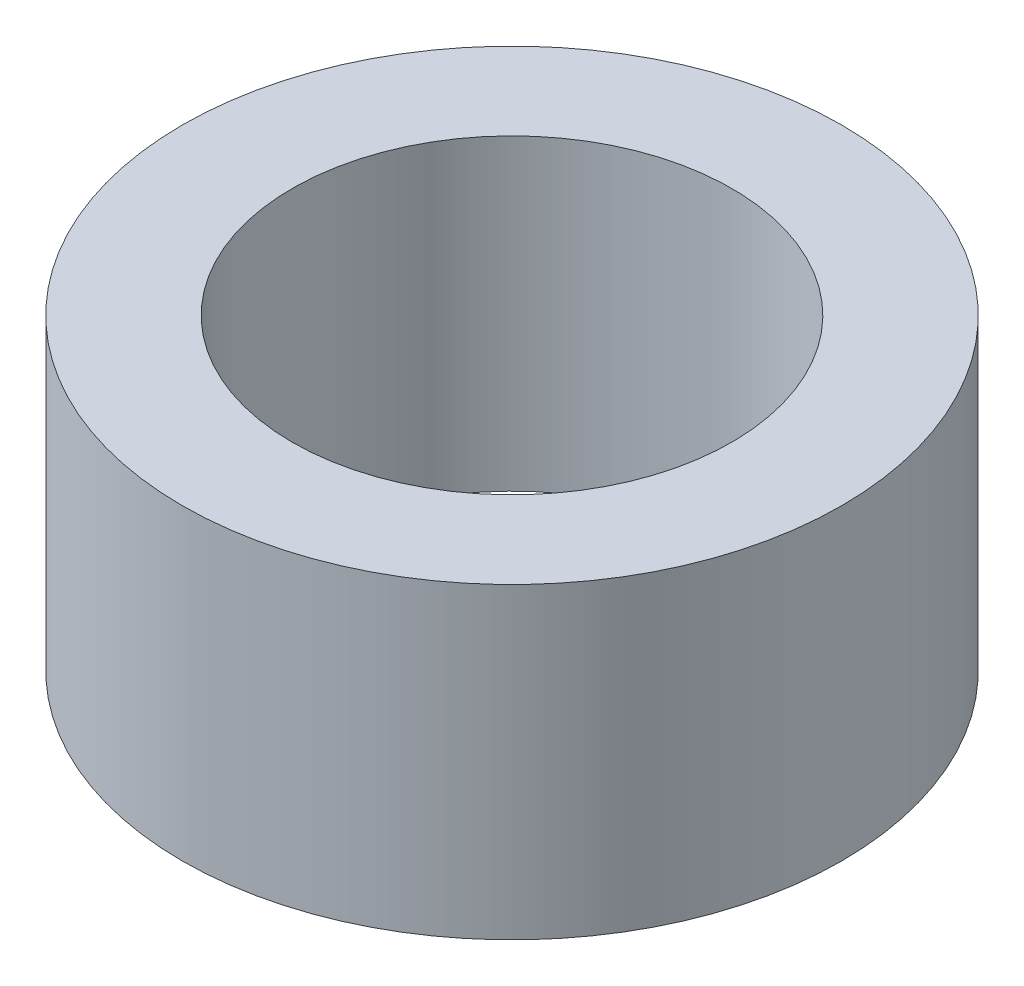
from build123d import *

# Parameters (mm, degrees)
SKETCH1_R           = 30
SKETCH1_R_2         = 20
BOSS_EXTRUDE1_DEPTH = 14


with BuildPart() as part:
    # Sketch1 → Boss-Extrude1 (new, symmetric)
    with BuildSketch(Plane(origin=(0, 0, 0), x_dir=(1, 0, 0), z_dir=(0, 1, 0))):
        with Locations(Location((0, 0, 0), (0, 0, 270))):
            Circle(SKETCH1_R)
        with Locations(Location((0, 0, 0), (0, 0, 270))):
            Circle(SKETCH1_R_2, mode=Mode.SUBTRACT)
    extrude(amount=BOSS_EXTRUDE1_DEPTH, both=True)


solid = part.part
